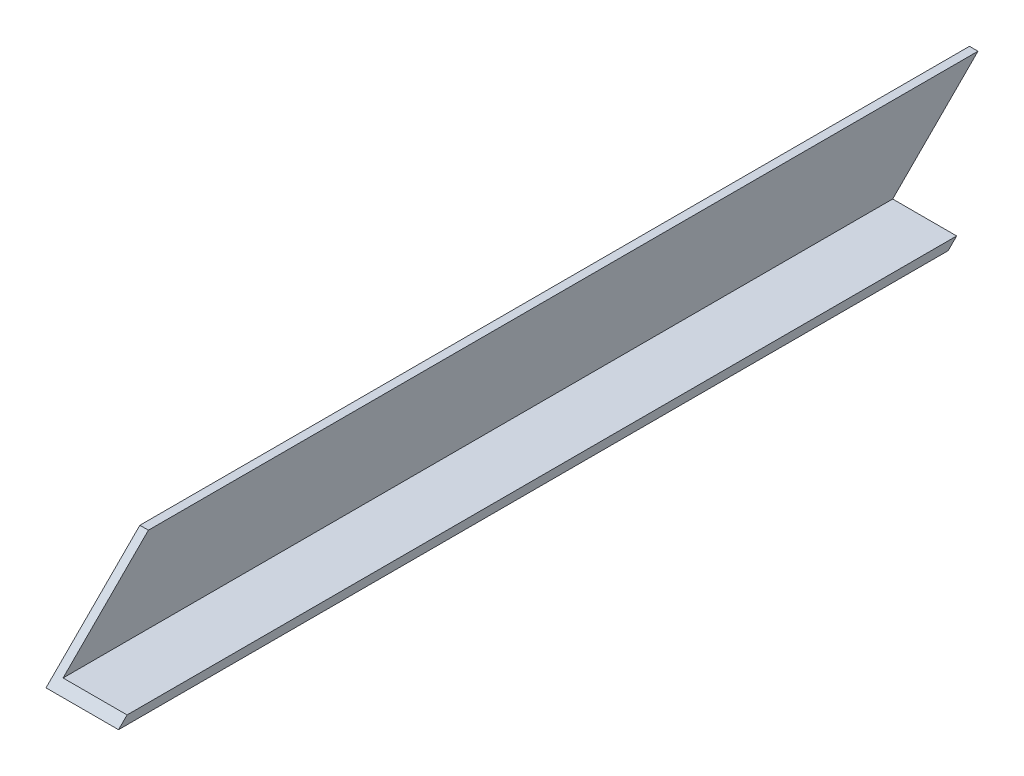
from build123d import *

# Parameters (mm, degrees)
BOSS_EXTRUDE1_DEPTH     = 250
CUT_EXTRUDE1_DEPTH      = 252.414001201
CUT_EXTRUDE1_DEPTH_BACK = 252.414001201


with BuildPart() as part:
    # Sketch1 → Boss-Extrude1 (new body)
    with BuildSketch(Plane.XY):
        Polygon((0, 0), (0, 22), (2, 22), (2, 2), (17, 2), (17, 0), align=None)
    extrude(amount=BOSS_EXTRUDE1_DEPTH)

    # Sketch2 → Cut-Extrude1 (cut, two sides: drawn at the far end of the back side and taken through both)
    with BuildSketch(Plane(origin=(2, 0, 0), x_dir=(0, 0, -1), z_dir=(1, 0, 0)).offset(-CUT_EXTRUDE1_DEPTH_BACK)):
        Polygon((-250, 22), (-250, 0), (-228, 22), align=None)
        Polygon((0, 22), (-33.545635174, 22), (-55.545635174, 0), (0, 0), align=None)
    extrude(amount=CUT_EXTRUDE1_DEPTH + CUT_EXTRUDE1_DEPTH_BACK, mode=Mode.SUBTRACT)


solid = part.part
